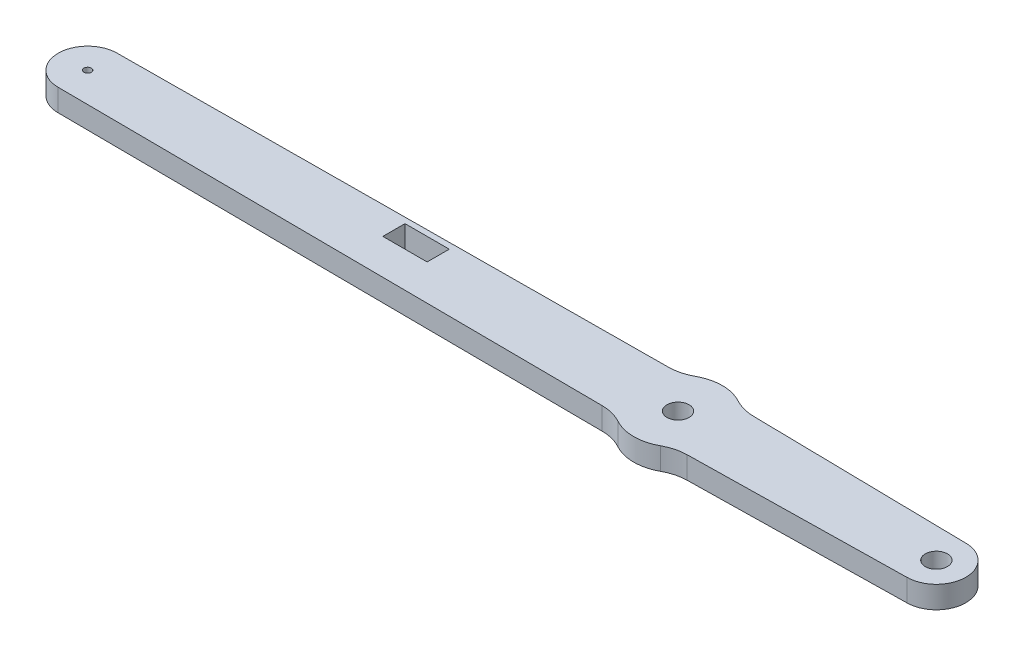
from build123d import *

# Parameters (mm, degrees)
CROQUIS1_R                 = 0.5
CROQUIS1_R_2               = 1.5
CROQUIS1_W                 = 6
CROQUIS1_H                 = 3
SALIENTE_EXTRUIR1_DEPTH    = 3
S_LIDO_MOVER_COPIAR1_ANGLE = 90


with BuildPart() as part:
    # Croquis1 → Saliente-Extruir1 (new body)
    with BuildSketch(Plane.XY):
        with BuildLine():
            Line((41932.264601563, -390.210765183), (41903.066277894, -389.706454081))
            ThreePointArc((41903.066277894, -389.706454081), (41901.568434997, -389.516485634), (41900.165439728, -388.958609632))
            ThreePointArc((41900.165439728, -388.958609632), (41897.263118587, -388.210765367), (41894.361167478, -388.960044231))
            ThreePointArc((41894.361167478, -388.960044231), (41892.97663061, -389.513886246), (41891.498273009, -389.709186322))
            Line((41891.498273009, -389.709186322), (41817.264601562, -390.210765183))
            ThreePointArc((41817.264601562, -390.210765183), (41813.264601563, -394.210765183), (41817.264601563, -398.210765183))
            Line((41817.264601563, -398.210765183), (41891.457733394, -398.712207088))
            ThreePointArc((41891.457733394, -398.712207088), (41892.957012268, -398.902545922), (41894.361167478, -399.461486136))
            ThreePointArc((41894.361167478, -399.461486136), (41897.263118587, -400.210765), (41900.165439728, -399.462920735))
            ThreePointArc((41900.165439728, -399.462920735), (41901.518409746, -398.918171578), (41902.962844991, -398.715967883))
            Line((41902.962844991, -398.715967883), (41932.264601563, -398.210765183))
            ThreePointArc((41932.264601563, -398.210765183), (41936.264601563, -394.210765183), (41932.264601563, -390.210765183))
        make_face()
        with Locations((41817.264601563, -394.210765183)):
            Circle(CROQUIS1_R, mode=Mode.SUBTRACT)
        with Locations((41932.264601563, -394.210765183)):
            Circle(CROQUIS1_R_2, mode=Mode.SUBTRACT)
        with Locations((41897.264601563, -394.210765183)):
            Circle(CROQUIS1_R_2, mode=Mode.SUBTRACT)
        with Locations((41859.764601563, -392.210765183)):
            Rectangle(CROQUIS1_W, CROQUIS1_H, mode=Mode.SUBTRACT)
    extrude(amount=SALIENTE_EXTRUIR1_DEPTH)


with BuildPart() as part_1:
    # Sólido-Mover/Copiar1: moved
    add(part.part.rotate(Axis((0, -394.210765183, 1.5), (-1, 0, 0)), S_LIDO_MOVER_COPIAR1_ANGLE))


solid = part_1.part
